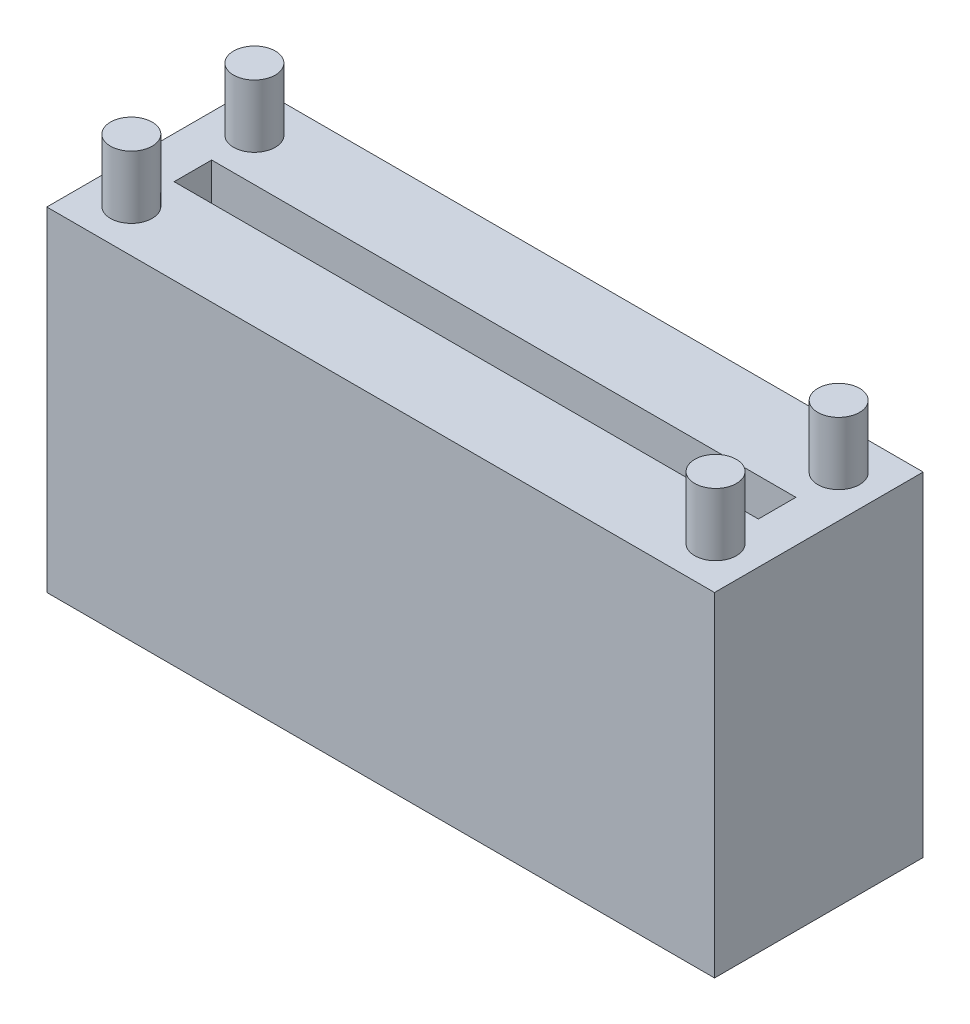
from build123d import *

# Parameters (mm, degrees)
SKETCH1_W           = 203.2
SKETCH1_H           = 63.5
BOSS_EXTRUDE1_DEPTH = 101.6
SKETCH3_W           = 177.8
SKETCH3_H           = 11.43
CUT_EXTRUDE1_DEPTH  = 6.35
CUT_EXTRUDE2_DEPTH  = 11.43
SKETCH5_R           = 6.35
BOSS_EXTRUDE2_DEPTH = 19.05
SKETCH6_R           = 6.858
CUT_EXTRUDE3_DEPTH  = 19.05
SKETCH7_W           = 50.8
SKETCH7_H           = 11.43
CUT_EXTRUDE4_DEPTH  = 161.894515133


with BuildPart() as part:
    # Sketch1 → Boss-Extrude1 (new body)
    with BuildSketch(Plane(origin=(0, 0, 0), x_dir=(1, 0, 0), z_dir=(0, 1, 0))):
        Rectangle(SKETCH1_W, SKETCH1_H)
    extrude(amount=BOSS_EXTRUDE1_DEPTH)

    # Sketch3 → Cut-Extrude1 (cut)
    with BuildSketch(Plane(origin=(0, 101.6, 0), x_dir=(1, 0, 0), z_dir=(0, 1, 0))):
        Rectangle(SKETCH3_W, SKETCH3_H)
    extrude(amount=-CUT_EXTRUDE1_DEPTH, mode=Mode.SUBTRACT)

    # Sketch4 → Cut-Extrude2 (cut)
    with BuildSketch(Plane.XY.offset(-5.715)):
        Polygon((-88.9, 101.6), (-88.9, 57.15), (88.9, 6.35), (88.9, 101.6), align=None)
    extrude(amount=CUT_EXTRUDE2_DEPTH, mode=Mode.SUBTRACT)

    # Sketch5 → Boss-Extrude2 (add)
    with BuildSketch(Plane(origin=(0, 101.6, 0), x_dir=(1, 0, 0), z_dir=(0, 1, 0))):
        with Locations(Location((88.9, -18.7325, 0), (0, 0, 90))):
            Circle(SKETCH5_R)
        with Locations(Location((-88.9, -18.7325, 0), (0, 0, 90))):
            Circle(SKETCH5_R)
        with Locations(Location((-88.9, 18.7325, 0), (0, 0, 90))):
            Circle(SKETCH5_R)
        with Locations(Location((88.9, 18.7325, 0), (0, 0, 90))):
            Circle(SKETCH5_R)
    extrude(amount=BOSS_EXTRUDE2_DEPTH)

    # Sketch6 → Cut-Extrude3 (cut)
    with BuildSketch(Plane.XZ):
        with Locations(Location((88.392, -18.796, 0), (0, 0, 270))):
            Circle(SKETCH6_R)
        with Locations(Location((-88.392, -18.796, 0), (0, 0, 270))):
            Circle(SKETCH6_R)
        with Locations(Location((-88.392, 18.669, 0), (0, 0, 270))):
            Circle(SKETCH6_R)
        with Locations(Location((88.392, 18.669, 0), (0, 0, 270))):
            Circle(SKETCH6_R)
    extrude(amount=-CUT_EXTRUDE3_DEPTH, mode=Mode.SUBTRACT)

    # Sketch7 → Cut-Extrude4 (cut, through all)
    with BuildSketch(Plane.XZ):
        with Locations((63.5, 0)):
            Rectangle(SKETCH7_W, SKETCH7_H)
    extrude(amount=-CUT_EXTRUDE4_DEPTH, mode=Mode.SUBTRACT)


solid = part.part
